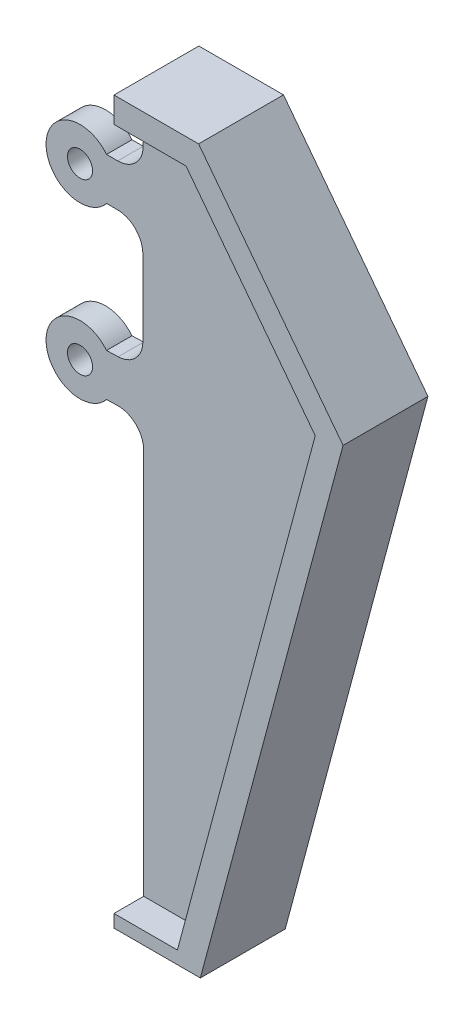
from build123d import *

# Parameters (mm, degrees)
BOSS_EXTRUDE4_DEPTH      = 5
BOSS_EXTRUDE4_DEPTH_BACK = 5
BOSS_EXTRUDE8_DEPTH      = 1.5
BOSS_EXTRUDE8_DEPTH_BACK = 1.5
BOSS_EXTRUDE9_START      = -6.5
BOSS_EXTRUDE9_DEPTH      = 10
SKETCH7_R                = 1.48
CUT_EXTRUDE4_DEPTH       = 3
SKETCH8_R                = 1.48
CUT_EXTRUDE5_DEPTH       = 3


with BuildPart() as part:
    # Sketch1 → Boss-Extrude4 (new, two sides: drawn at the far end of the back side and taken through both)
    with BuildSketch(Plane.XY.offset(-BOSS_EXTRUDE4_DEPTH_BACK)):
        Polygon((57.854367278, 21.520362054), (66.342730398, 21.520362054), (81.563363175, 1.615876121), (64.92491937, -60.479638348), (68.030747921, -60.479638348), (84.843243231, 2.265445145), (67.825274573, 24.520362054), (57.854367278, 24.520362054), align=None)
    extrude(amount=BOSS_EXTRUDE4_DEPTH + BOSS_EXTRUDE4_DEPTH_BACK)



with BuildPart() as body_2:
    # Sketch4 → Boss-Extrude8 (new, two sides: drawn at the far end of the back side and taken through both)
    with BuildSketch(Plane.XY.offset(-BOSS_EXTRUDE8_DEPTH_BACK)):
        with BuildLine():
            Line((57.854216238, 21.518374124), (66.342579359, 21.518374124))
            Line((66.342579359, 21.518374124), (81.563212135, 1.613888191))
            Line((81.563212135, 1.613888191), (64.92476833, -60.481626279))
            Line((64.92476833, -60.481626279), (57.854216238, -60.481626279))
            Line((57.854216238, -60.481626279), (57.854216238, -13.452758872))
            ThreePointArc((57.854216238, -13.452758872), (56.952658997, -11.308805051), (54.789857581, -10.453449291))
            Line((54.789857581, -10.453449291), (53.476715385, -10.481626465))
            ThreePointArc((53.476715385, -10.481626465), (46.354216528, -7.981626288), (53.476715385, -5.481626111))
            Line((53.476715385, -5.481626111), (54.850195116, -5.438621709))
            ThreePointArc((54.850195116, -5.438621709), (56.910567696, -4.527954069), (57.756309483, -2.440091154))
            Line((57.756309483, -2.440091154), (57.756309483, 6.518373554))
            ThreePointArc((57.756309483, 6.518373554), (56.877629826, 8.639693897), (54.756309483, 9.518373554))
            Line((54.756309483, 9.518373554), (53.476715385, 9.518373554))
            ThreePointArc((53.476715385, 9.518373554), (46.354216528, 12.018373731), (53.476715385, 14.518373908))
            Line((53.476715385, 14.518373908), (54.797976093, 14.518373908))
            ThreePointArc((54.797976093, 14.518373908), (56.904410545, 15.382271406), (57.797682695, 17.476417975))
            Line((57.797682695, 17.476417975), (57.854216238, 21.518374124))
        make_face()
    extrude(amount=BOSS_EXTRUDE8_DEPTH + BOSS_EXTRUDE8_DEPTH_BACK)


with BuildPart() as part_1:
    add(part.part)

    add(body_2.part)  # Boss-Extrude9 merges body 2
    # Sketch6 → Boss-Extrude9 (add)
    with BuildSketch(Plane.XY.offset(1.5).offset(BOSS_EXTRUDE9_START)):
        Polygon((57.854216238, -60.481626279), (57.854216238, -58.981626279), (65.326692139, -58.981626279), (64.92491937, -60.479638348), align=None)
    extrude(amount=BOSS_EXTRUDE9_DEPTH)

    # Sketch7 → Cut-Extrude4 (cut)
    with BuildSketch(Plane.XY.offset(1.5)):
        with Locations((50.354216528, -7.981626288)):
            Circle(SKETCH7_R)
    extrude(amount=-CUT_EXTRUDE4_DEPTH, mode=Mode.SUBTRACT)

    # Sketch8 → Cut-Extrude5 (cut)
    with BuildSketch(Plane.XY.offset(1.5)):
        with Locations((50.354216528, 12.018373731)):
            Circle(SKETCH8_R)
    extrude(amount=-CUT_EXTRUDE5_DEPTH, mode=Mode.SUBTRACT)


solid = part_1.part
